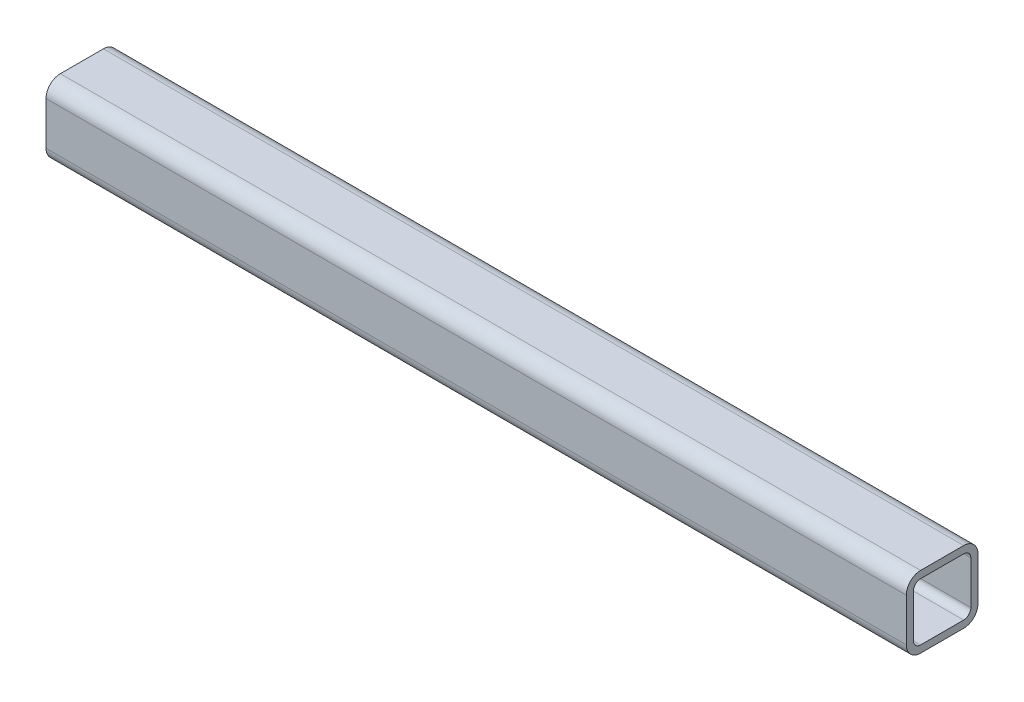
from build123d import *

# Parameters (mm, degrees)
TUBE_SQUARE_RHS50X50X5_1_DEPTH = 600


with BuildPart() as part:
    # Sketch1 → Tube (square) RHS50X50X5(1) (new body)
    with BuildSketch(Plane.YZ):
        with BuildLine():
            Line((-15, -25), (15, -25))
            ThreePointArc((15, -25), (22.071067812, -22.071067812), (25, -15))
            Line((25, -15), (25, 15))
            ThreePointArc((25, 15), (22.071067812, 22.071067812), (15, 25))
            Line((15, 25), (-15, 25))
            ThreePointArc((-15, 25), (-22.071067812, 22.071067812), (-25, 15))
            Line((-25, 15), (-25, -15))
            ThreePointArc((-25, -15), (-22.071067812, -22.071067812), (-15, -25))
        make_face()
        with BuildLine():
            Line((-15, -20), (15, -20))
            ThreePointArc((15, -20), (18.535533906, -18.535533906), (20, -15))
            Line((20, -15), (20, 15))
            ThreePointArc((20, 15), (18.535533906, 18.535533906), (15, 20))
            Line((15, 20), (-15, 20))
            ThreePointArc((-15, 20), (-18.535533906, 18.535533906), (-20, 15))
            Line((-20, 15), (-20, -15))
            ThreePointArc((-20, -15), (-18.535533906, -18.535533906), (-15, -20))
        make_face(mode=Mode.SUBTRACT)
    extrude(amount=TUBE_SQUARE_RHS50X50X5_1_DEPTH)


solid = part.part
